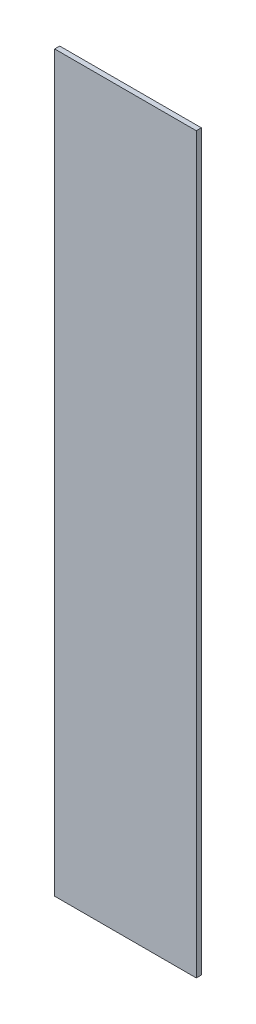
from build123d import *

# Parameters (mm, degrees)
SKETCH1_W           = 177.8
SKETCH1_H           = 920.75
BOSS_EXTRUDE1_DEPTH = 6.35


with BuildPart() as part:
    # Sketch1 → Boss-Extrude1 (new body)
    with BuildSketch(Plane.XY):
        Rectangle(SKETCH1_W, SKETCH1_H)
    extrude(amount=BOSS_EXTRUDE1_DEPTH)


solid = part.part
